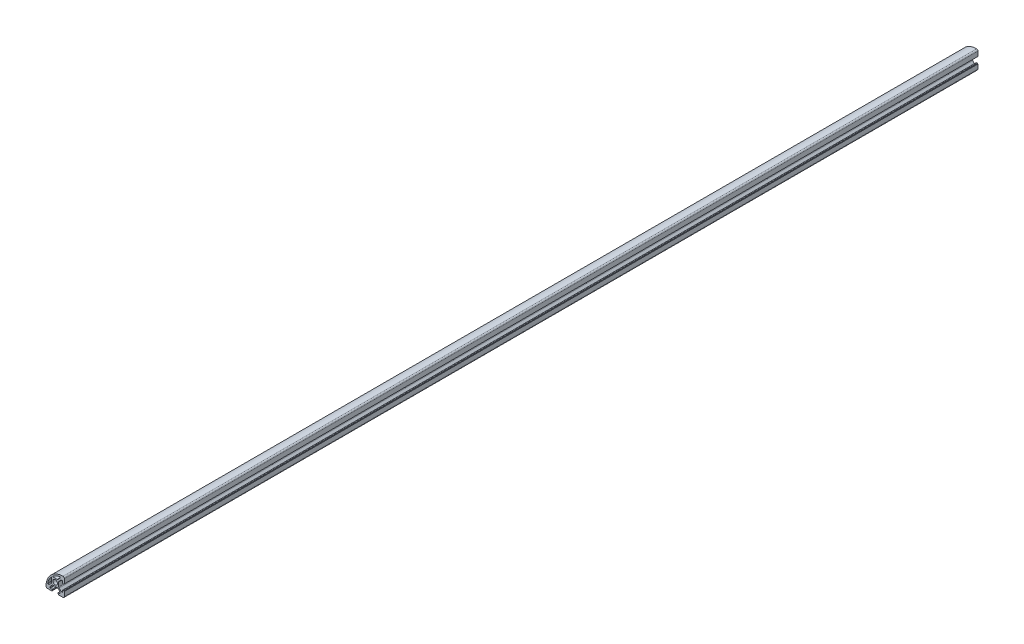
from build123d import *

# Parameters (mm, degrees)
SKETCH_1_R      = 2.5
EXTRUDE_1_DEPTH = 1000


with BuildPart() as part:
    # 草图1 → 凸台-拉伸1 (new body)
    with BuildSketch(Plane.XY):
        with BuildLine():
            Line((4.215995631, 3.129161171), (6.436655803, 5.349821343))
            Line((6.436655803, 5.349821343), (7.776655803, 5.349821343))
            ThreePointArc((7.776655803, 5.349821343), (7.988787838, 5.261953377), (8.076655803, 5.049821343))
            Line((8.076655803, 5.049821343), (8.076655803, 3.249821343))
            ThreePointArc((8.076655803, 3.249821343), (8.164523769, 3.037689308), (8.376655803, 2.949821343))
            Line((8.376655803, 2.949821343), (9.376655803, 2.949821343))
            Line((9.376655803, 2.949821343), (9.376655803, 3.249821343))
            ThreePointArc((9.376655803, 3.249821343), (9.435234447, 3.391242699), (9.576655803, 3.449821343))
            Line((9.576655803, 3.449821343), (9.99208048, 3.449821343))
            Line((9.99208048, 3.449821343), (9.99208048, 8.46524602))
            ThreePointArc((9.99208048, 8.46524602), (9.552740652, 9.525906191), (8.49208048, 9.96524602))
            ThreePointArc((8.49208048, 9.96524602), (-4.671012544, 4.512914366), (-10.123344197, -8.650178657))
            ThreePointArc((-10.123344197, -8.650178657), (-9.684004369, -9.710838829), (-8.623344197, -10.150178657))
            Line((-8.623344197, -10.150178657), (-3.723344197, -10.150178657))
            Line((-3.723344197, -10.150178657), (-3.723344197, -9.850178657))
            ThreePointArc((-3.723344197, -9.850178657), (-3.664765553, -9.708757301), (-3.523344197, -9.650178657))
            Line((-3.523344197, -9.650178657), (-3.223344197, -9.650178657))
            Line((-3.223344197, -9.650178657), (-3.223344197, -8.650178657))
            ThreePointArc((-3.223344197, -8.650178657), (-3.311212162, -8.438046623), (-3.523344197, -8.350178657))
            Line((-3.523344197, -8.350178657), (-5.323344197, -8.350178657))
            ThreePointArc((-5.323344197, -8.350178657), (-5.535476231, -8.262310692), (-5.623344197, -8.050178657))
            Line((-5.623344197, -8.050178657), (-5.623344197, -6.710178657))
            Line((-5.623344197, -6.710178657), (-3.402684025, -4.489518485))
            ThreePointArc((-3.402684025, -4.489518485), (-2.916049002, -4.164359358), (-2.342023853, -4.050178657))
            Line((-2.342023853, -4.050178657), (2.09533546, -4.050178657))
            ThreePointArc((2.09533546, -4.050178657), (2.669360608, -4.164359358), (3.155995631, -4.489518485))
            Line((3.155995631, -4.489518485), (5.376655803, -6.710178657))
            Line((5.376655803, -6.710178657), (5.376655803, -8.050178657))
            ThreePointArc((5.376655803, -8.050178657), (5.288787838, -8.262310692), (5.076655803, -8.350178657))
            Line((5.076655803, -8.350178657), (3.276655803, -8.350178657))
            ThreePointArc((3.276655803, -8.350178657), (3.064523769, -8.438046623), (2.976655803, -8.650178657))
            Line((2.976655803, -8.650178657), (2.976655803, -9.650178657))
            Line((2.976655803, -9.650178657), (3.276655803, -9.650178657))
            ThreePointArc((3.276655803, -9.650178657), (3.418077159, -9.708757301), (3.476655803, -9.850178657))
            Line((3.476655803, -9.850178657), (3.476655803, -10.150178657))
            Line((3.476655803, -10.150178657), (8.376655803, -10.150178657))
            ThreePointArc((8.376655803, -10.150178657), (9.437315975, -9.710838829), (9.876655803, -8.650178657))
            Line((9.876655803, -8.650178657), (9.876655803, -3.750178657))
            Line((9.876655803, -3.750178657), (9.576655803, -3.750178657))
            ThreePointArc((9.576655803, -3.750178657), (9.435234447, -3.691600013), (9.376655803, -3.550178657))
            Line((9.376655803, -3.550178657), (9.376655803, -3.250178657))
            Line((9.376655803, -3.250178657), (8.376655803, -3.250178657))
            ThreePointArc((8.376655803, -3.250178657), (8.164523769, -3.338046623), (8.076655803, -3.550178657))
            Line((8.076655803, -3.550178657), (8.076655803, -5.350178657))
            ThreePointArc((8.076655803, -5.350178657), (7.988787838, -5.562310692), (7.776655803, -5.650178657))
            Line((7.776655803, -5.650178657), (6.436655803, -5.650178657))
            Line((6.436655803, -5.650178657), (4.215995631, -3.429518485))
            ThreePointArc((4.215995631, -3.429518485), (3.890836504, -2.942883462), (3.776655803, -2.368858314))
            Line((3.776655803, -2.368858314), (3.776655803, 2.068500999))
            ThreePointArc((3.776655803, 2.068500999), (3.890836504, 2.642526148), (4.215995631, 3.129161171))
        make_face()
        with Locations((-0.123344197, -0.035109627)):
            Circle(SKETCH_1_R, mode=Mode.SUBTRACT)
        with BuildLine():
            Line((5.376655803, 7.864890373), (5.376655803, 6.524890373))
            Line((5.376655803, 6.524890373), (3.155995631, 4.304230202))
            ThreePointArc((3.155995631, 4.304230202), (2.669360608, 3.979071075), (2.09533546, 3.864890373))
            Line((2.09533546, 3.864890373), (-2.342023853, 3.864890373))
            ThreePointArc((-2.342023853, 3.864890373), (-2.69419221, 3.906817176), (-3.026673509, 4.030253775))
            ThreePointArc((-3.026673509, 4.030253775), (0.896523465, 6.557813899), (5.376655803, 7.864890373))
        make_face(mode=Mode.SUBTRACT)
        with BuildLine():
            Line((-4.023344197, 2.18357003), (-4.023344197, -2.253789283))
            ThreePointArc((-4.023344197, -2.253789283), (-4.137524898, -2.827814432), (-4.462684025, -3.314449455))
            Line((-4.462684025, -3.314449455), (-6.683344197, -5.535109627))
            Line((-6.683344197, -5.535109627), (-8.023344197, -5.535109627))
            ThreePointArc((-8.023344197, -5.535109627), (-8.235476231, -5.447241661), (-8.323344197, -5.235109627))
            ThreePointArc((-8.323344197, -5.235109627), (-6.845791054, -0.874365796), (-4.203440462, 2.89620888))
            ThreePointArc((-4.203440462, 2.89620888), (-4.069065062, 2.551091728), (-4.023344197, 2.18357003))
        make_face(mode=Mode.SUBTRACT)
    extrude(amount=EXTRUDE_1_DEPTH)


solid = part.part
